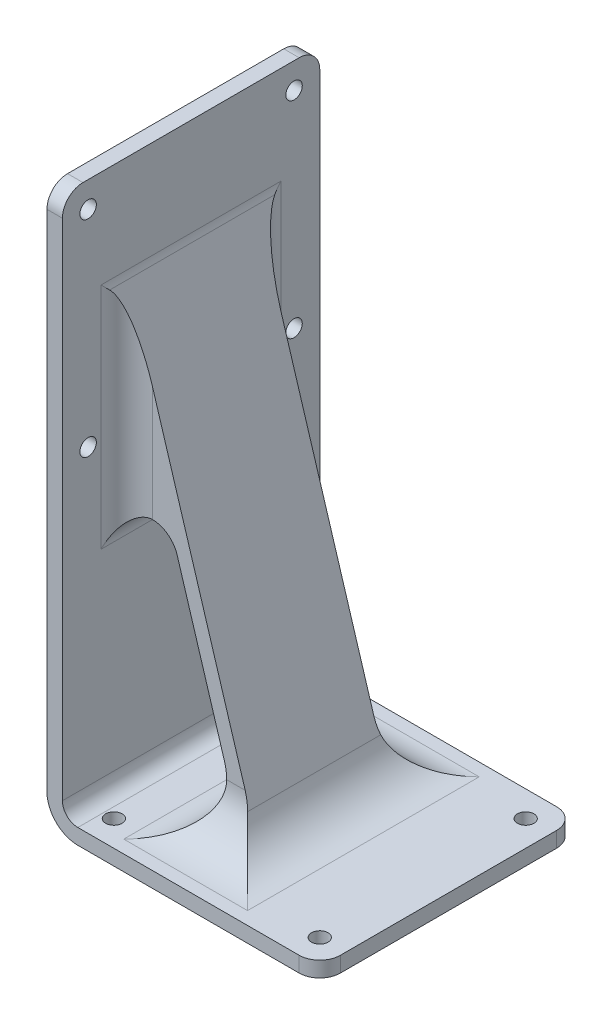
from build123d import *

# Parameters (mm, degrees)
SKETCH2_W           = 50
SKETCH2_H           = 50
BOSS_EXTRUDE1_DEPTH = 3
SKETCH3_R           = 1.6
CUT_EXTRUDE1_DEPTH  = 3
FILLET1_R           = 4
SKETCH4_W           = 50
SKETCH4_H           = 3
BOSS_EXTRUDE2_DEPTH = 3
SKETCH5_W           = 3
SKETCH5_H           = 50
BOSS_EXTRUDE3_DEPTH = 55
SKETCH6_W           = 3
SKETCH6_H           = 50
BOSS_EXTRUDE4_DEPTH = 50
SKETCH7_R           = 1.6
CUT_EXTRUDE2_DEPTH  = 3
FILLET2_R           = 4
FILLET3_R           = 3
FILLET4_R           = 6
BOSS_EXTRUDE5_DEPTH = 12.5
FILLET5_R           = 5
FILLET6_R           = 10


with BuildPart() as part:
    # Sketch2 → Boss-Extrude1 (new body)
    with BuildSketch(Plane(origin=(0, 0, 0), x_dir=(1, 0, 0), z_dir=(0, 1, 0))):
        Rectangle(SKETCH2_W, SKETCH2_H)
    extrude(amount=BOSS_EXTRUDE1_DEPTH)

    # Sketch3 → Cut-Extrude1 (cut)
    with BuildSketch(Plane(origin=(0, 3, 0), x_dir=(1, 0, 0), z_dir=(0, 1, 0))):
        with Locations(Location((-20, 20, 0), (0, 0, 270))):
            Circle(SKETCH3_R)
        with Locations(Location((20, 20, 0), (0, 0, 270))):
            Circle(SKETCH3_R)
        with Locations(Location((-20, -20, 0), (0, 0, 270))):
            Circle(SKETCH3_R)
        with Locations(Location((20, -20, 0), (0, 0, 270))):
            Circle(SKETCH3_R)
    extrude(amount=-CUT_EXTRUDE1_DEPTH, mode=Mode.SUBTRACT)

    # Fillet1
    fillet1_edges = [part.edges().sort_by_distance(p)[0] for p in [
        (25, 1.5, 25),
        (25, 1.5, -25),
    ]]
    fillet(fillet1_edges, radius=FILLET1_R)

    # Sketch4 → Boss-Extrude2 (add)
    with BuildSketch(Plane.ZY.offset(25)):
        with Locations((0, 1.5)):
            Rectangle(SKETCH4_W, SKETCH4_H)
    extrude(amount=BOSS_EXTRUDE2_DEPTH)

    # Sketch5 → Boss-Extrude3 (add)
    with BuildSketch(Plane(origin=(0, 3, 0), x_dir=(1, 0, 0), z_dir=(0, 1, 0))):
        with Locations((-26.5, 0)):
            Rectangle(SKETCH5_W, SKETCH5_H)
    extrude(amount=BOSS_EXTRUDE3_DEPTH)

    # Sketch6 → Boss-Extrude4 (add)
    with BuildSketch(Plane(origin=(0, 58, 0), x_dir=(1, 0, 0), z_dir=(0, 1, 0))):
        with Locations((-26.5, 0)):
            Rectangle(SKETCH6_W, SKETCH6_H)
    extrude(amount=BOSS_EXTRUDE4_DEPTH)

    # Sketch7 → Cut-Extrude2 (cut)
    with BuildSketch(Plane(origin=(-25, 0, 0), x_dir=(0, 0, -1), z_dir=(1, 0, 0))):
        with Locations((-20, 63)):
            Circle(SKETCH7_R)
        with Locations((-20, 103)):
            Circle(SKETCH7_R)
        with Locations((20, 103)):
            Circle(SKETCH7_R)
        with Locations((20, 63)):
            Circle(SKETCH7_R)
    extrude(amount=-CUT_EXTRUDE2_DEPTH, mode=Mode.SUBTRACT)

    # Fillet2
    fillet2_edges = [part.edges().sort_by_distance(p)[0] for p in [
        (-26.5, 108, 25),
        (-26.5, 108, -25),
    ]]
    fillet(fillet2_edges, radius=FILLET2_R)

    # Fillet3
    fillet3_edges = [part.edges().sort_by_distance(p)[0] for p in [
        (-25, 3, 0),
    ]]
    fillet(fillet3_edges, radius=FILLET3_R)

    # Fillet4
    fillet4_edges = [part.edges().sort_by_distance(p)[0] for p in [
        (-28, 0, 0),
    ]]
    fillet(fillet4_edges, radius=FILLET4_R)

    # Sketch8 → Boss-Extrude5 (add, symmetric)
    with BuildSketch(Plane.XY):
        Polygon((-2.068537635, 3), (1.068537635, 3), (-25, 88.266344583), (-25, 78.005433723), align=None)
    extrude(amount=BOSS_EXTRUDE5_DEPTH, both=True)

    # Fillet5
    fillet5_edges = [part.edges().sort_by_distance(p)[0] for p in [
        (-25, 83.135889153, -12.5),
        (-25, 88.266344583, 0),
        (-25, 78.005433723, 0),
        (-25, 83.135889153, 12.5),
    ]]
    fillet(fillet5_edges, radius=FILLET5_R)

    # Fillet6
    fillet6_edges = [part.edges().sort_by_distance(p)[0] for p in [
        (1.068537635, 3, 0),
        (-0.5, 3, -12.5),
        (-2.068537635, 3, 0),
        (-0.5, 3, 12.5),
    ]]
    fillet(fillet6_edges, radius=FILLET6_R)


solid = part.part
